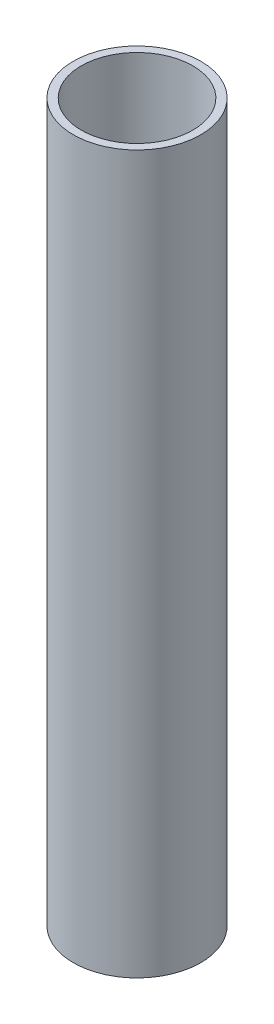
from build123d import *

# Parameters (mm, degrees)
SKETCH1_R           = 8
SKETCH1_R_2         = 7
BOSS_EXTRUDE1_DEPTH = 90


with BuildPart() as part:
    # Sketch1 → Boss-Extrude1 (new body)
    with BuildSketch(Plane(origin=(0, 0, 0), x_dir=(1, 0, 0), z_dir=(0, 1, 0))):
        with Locations(Location((0, 0, 0), (0, 0, 90))):
            Circle(SKETCH1_R)
        with Locations(Location((0, 0, 0), (0, 0, 90))):
            Circle(SKETCH1_R_2, mode=Mode.SUBTRACT)
    extrude(amount=BOSS_EXTRUDE1_DEPTH)


solid = part.part
